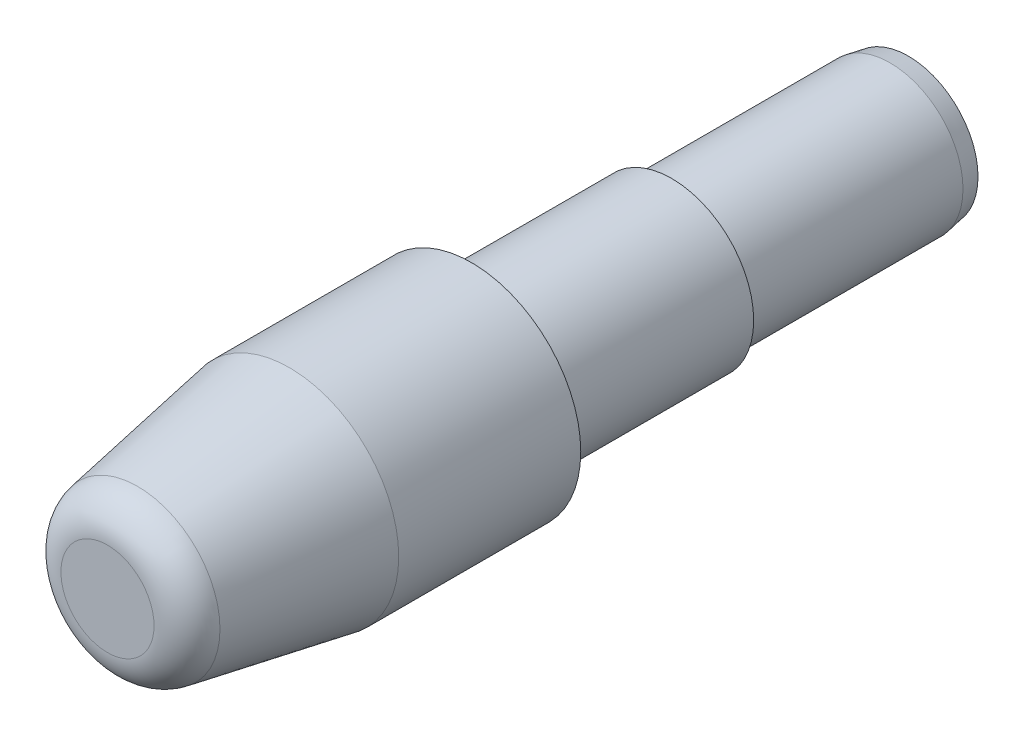
from build123d import *

# Parameters (mm, degrees)
CROQUIS1_R              = 6
SALIENTE_EXTRUIR1_DEPTH = 10
CROQUIS2_R              = 6
SALIENTE_EXTRUIR2_DEPTH = 10
CHAFL_N1_SIZE           = 10
CHAFL_N1_SIZE2          = 1.763269807
REDONDEO1_R             = 2
CROQUIS3_R              = 4.5
SALIENTE_EXTRUIR3_DEPTH = 11
CROQUIS4_R              = 4
SALIENTE_EXTRUIR4_DEPTH = 13
CHAFL_N2_SIZE           = 1
CHAFL_N2_SIZE2          = 0.176326981


with BuildPart() as part:
    # Croquis1 → Saliente-Extruir1 (new body)
    with BuildSketch(Plane.XY):
        Circle(CROQUIS1_R)
    extrude(amount=SALIENTE_EXTRUIR1_DEPTH)

    # Croquis2 → Saliente-Extruir2 (add)
    with BuildSketch(Plane.XY.offset(10)):
        Circle(CROQUIS2_R)
    extrude(amount=SALIENTE_EXTRUIR2_DEPTH)

    # Chaflán1
    chafl_n1_edges = [part.edges().sort_by_distance(p)[0] for p in [
        (-6, 0, 20),
    ]]
    chafl_n1_side = [part.faces().sort_by_distance(p)[0] for p in [
        (-6, 0, 10),
    ]]
    chamfer(chafl_n1_edges, length=CHAFL_N1_SIZE, length2=CHAFL_N1_SIZE2, reference=chafl_n1_side[0])

    # Redondeo1
    redondeo1_edges = [part.edges().sort_by_distance(p)[0] for p in [
        (-4.236730193, 0, 20),
    ]]
    fillet(redondeo1_edges, radius=REDONDEO1_R)

    # Croquis3 → Saliente-Extruir3 (add)
    with BuildSketch(Plane(origin=(0, 0, 0), x_dir=(-1, 0, 0), z_dir=(0, 0, -1))):
        with Locations(Location((0, 0, 0), (0, 0, 180))):
            Circle(CROQUIS3_R)
    extrude(amount=SALIENTE_EXTRUIR3_DEPTH)

    # Croquis4 → Saliente-Extruir4 (add)
    with BuildSketch(Plane(origin=(0, 0, -11), x_dir=(-1, 0, 0), z_dir=(0, 0, -1))):
        with Locations(Location((0, 0, 0), (0, 0, 180))):
            Circle(CROQUIS4_R)
    extrude(amount=SALIENTE_EXTRUIR4_DEPTH)

    # Chaflán2
    chafl_n2_edges = [part.edges().sort_by_distance(p)[0] for p in [
        (-4, 0, -24),
    ]]
    chafl_n2_side = [part.faces().sort_by_distance(p)[0] for p in [
        (-4, 0, -17.5),
    ]]
    chamfer(chafl_n2_edges, length=CHAFL_N2_SIZE, length2=CHAFL_N2_SIZE2, reference=chafl_n2_side[0])


solid = part.part
